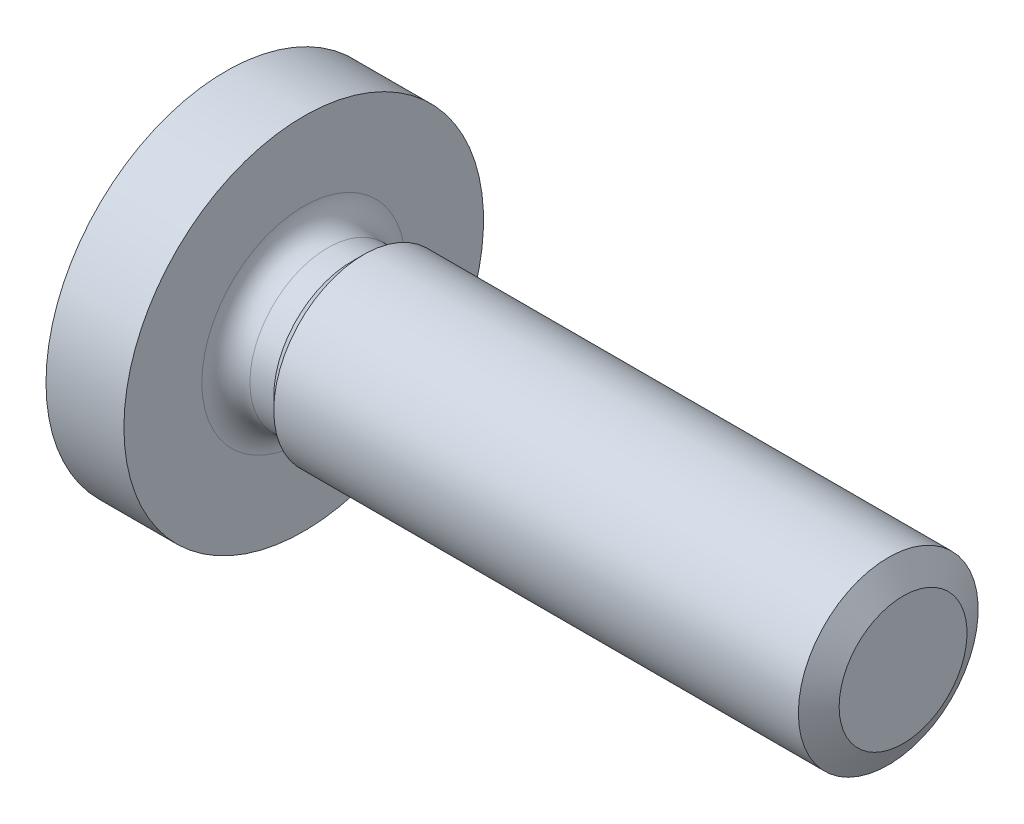
from build123d import *


with BuildPart() as part:
    # 草图2 → Revolve 706 (revolve)
    with BuildSketch(Plane.XY, mode=Mode.PRIVATE) as revolve_706_sk:
        with BuildLine():
            Line((0, 0), (24.6, 0))
            Line((24.6, 0), (24.6, 3))
            Line((24.6, 3), (6.6, 3))
            Line((6.6, 3), (6.198, 2.598))
            Line((6.198, 2.598), (5.402, 2.598))
            ThreePointArc((5.402, 2.598), (4.834900361, 2.832900361), (4.6, 3.4))
            Line((4.6, 3.4), (4.6, 6))
            Line((4.6, 6), (2, 6))
            ThreePointArc((2, 6), (0.513167019, 3.16227766), (0, 0))
        make_face()
    revolve(revolve_706_sk.sketch.rotate(Axis((-1.331757704, 0, 0), (1, 0, 0)), 90), axis=Axis((-1.331757704, 0, 0), (1, 0, 0)))

    # 草图3 → 切除-旋转1 (revolve, cut)
    with BuildSketch(Plane.XY, mode=Mode.PRIVATE) as cut_revolve_1_sk:
        Polygon((24.105416006, 3), (25.105416006, 3), (24.6, 2.134), align=None)
    revolve(cut_revolve_1_sk.sketch.rotate(Axis((-0.242766179, 0, 0), (1, 0, 0)), 90), axis=Axis((-0.242766179, 0, 0), (1, 0, 0)), mode=Mode.SUBTRACT)

    # 草图5 → 切除-放样1 section 0
    with BuildSketch(Plane(origin=(0, 0, 0), x_dir=(0, 0, -1), z_dir=(1, 0, 0)), mode=Mode.PRIVATE) as loft_1_s0:
        with BuildLine():
            Line((0.5, 3.45), (-0.5, 3.45))
            Line((-0.5, 3.45), (-0.5, -3.45))
            Line((-0.5, -3.45), (0.5, -3.45))
            Line((0.5, -3.45), (0.5, 3.45))
        make_face()
    loft_1 = loft([Vertex(3.6, 0, 0), loft_1_s0.sketch], mode=Mode.SUBTRACT)

    # 镜向1: 切除-放样1 across plane
    add(loft_1.mirror(Plane(origin=(0, 0, 0), x_dir=(0, 0.7071067811865462, 0.7071067811865488), z_dir=(0, -0.7071067811865488, 0.7071067811865462))), mode=Mode.SUBTRACT)


solid = part.part
